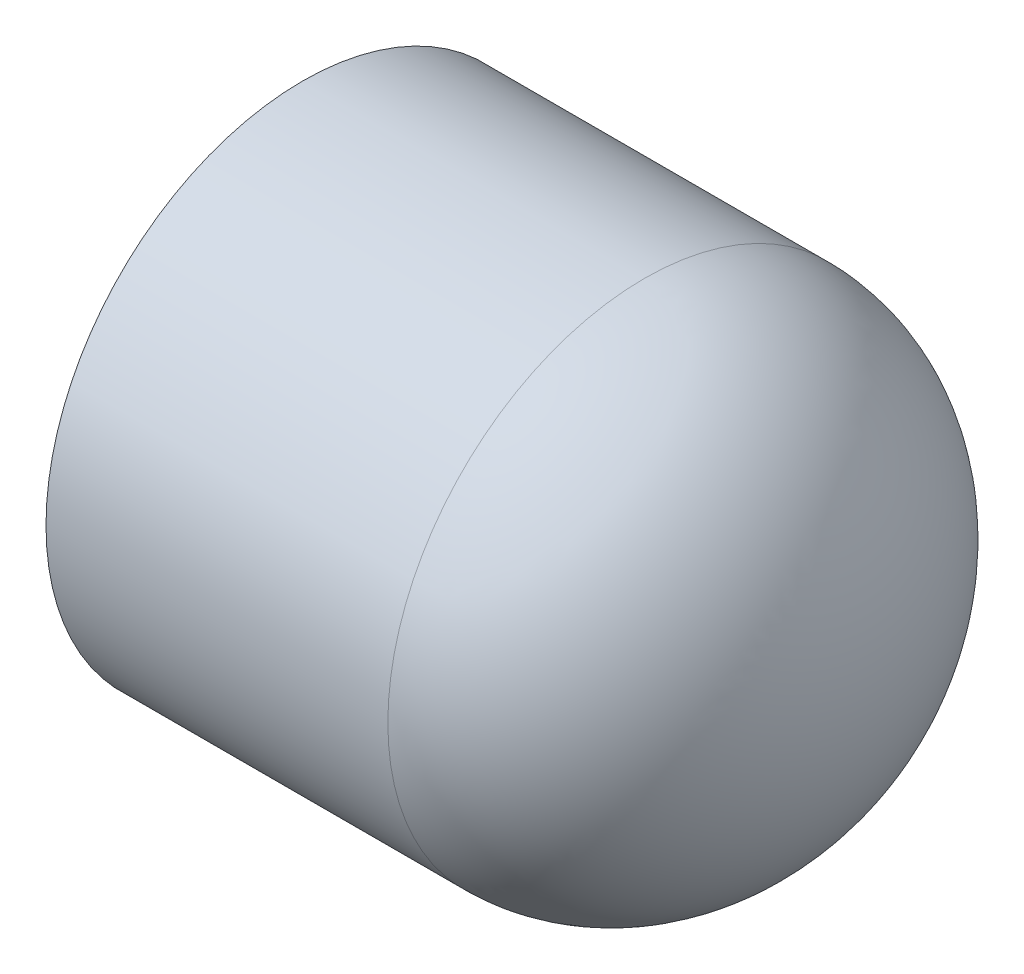
from build123d import *


with BuildPart() as part:
    # Sketch1 → Revolve1 (revolve)
    with BuildSketch(Plane.XY, mode=Mode.PRIVATE) as revolve1_sk:
        with BuildLine():
            Line((11.7221, 0), (14.7193, 0))
            add(Edge.make_bspline(
                [(3.4163, -13.6144), (14.7193, -13.6144), (14.7193, 0)],
                knots=[3.141592654, 3.141592654, 3.141592654, 4.71238898, 4.71238898, 4.71238898], degree=2, weights=[1, 0.707106781, 1]))
            Line((3.4163, -13.6144), (-14.7193, -13.6144))
            Line((-14.7193, -13.6144), (-14.7193, -10.7696))
            Line((-14.7193, -10.7696), (3.4163, -10.6172))
            add(Edge.make_bspline(
                [(3.4163, -10.6172), (11.7221, -10.6172), (11.7221, 0)],
                knots=[0, 0, 0, 1.570796327, 1.570796327, 1.570796327], degree=2, weights=[1, 0.707106781, 1]))
        make_face()
    revolve(revolve1_sk.sketch.rotate(Axis((-14.7193, 0, 0), (1, 0, 0)), 270), axis=Axis((-14.7193, 0, 0), (1, 0, 0)))


solid = part.part
